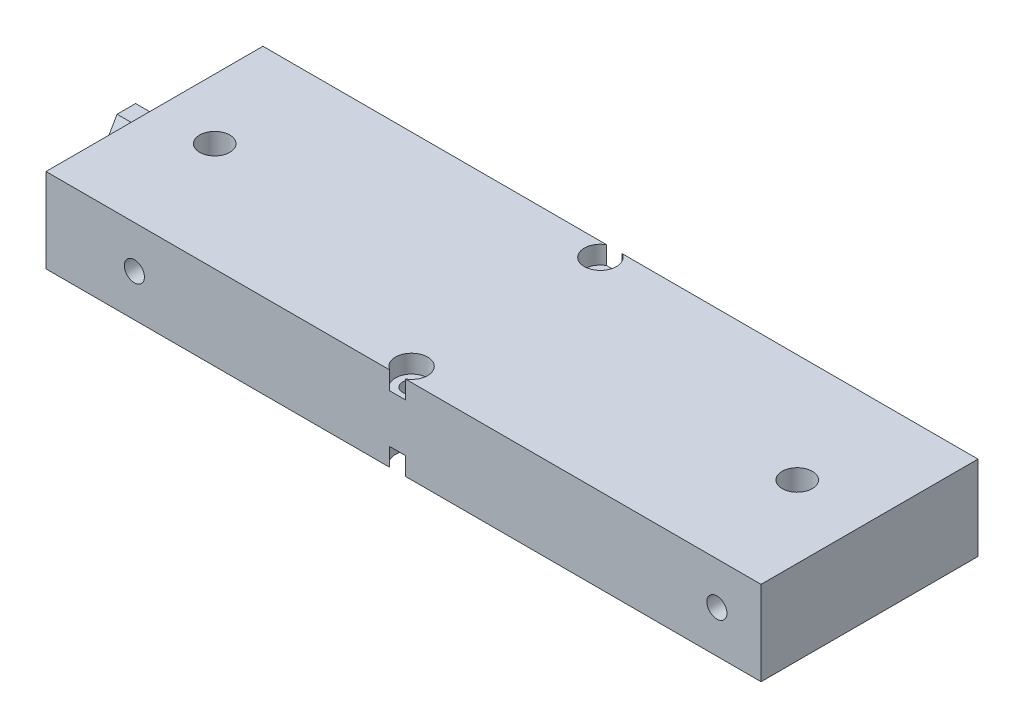
from build123d import *

# Parameters (mm, degrees)
SKETCH_1_W          = 178
SKETCH_1_H          = 54
EXTRUDE_1_DEPTH     = 21
SKETCH_2_R          = 4
CUT_EXTRUDE_1_DEPTH = 125
SKETCH_3_R          = 2.25
CUT_EXTRUDE_2_DEPTH = 188.192414376
SKETCH_4_R          = 4
CUT_EXTRUDE_3_DEPTH = 4.5
SKETCH_5_R          = 3.75
CUT_EXTRUDE_4_DEPTH = 7.2
SKETCH_6_R          = 2.5
CUT_EXTRUDE_5_DEPTH = 5
EXTRUDE_2_DEPTH     = 7


with BuildPart() as part:
    # 草图1 → 凸台-拉伸1 (new body)
    with BuildSketch(Plane(origin=(0, 0, 0), x_dir=(1, 0, 0), z_dir=(0, 1, 0))):
        with Locations((89, 27)):
            Rectangle(SKETCH_1_W, SKETCH_1_H)
    extrude(amount=EXTRUDE_1_DEPTH)

    # 草图2 → 切除-拉伸1 (cut)
    with BuildSketch(Plane.ZY):
        with Locations((-15, 10.5)):
            Circle(SKETCH_2_R)
        with Locations(Location((-39, 10.5, 0), (0, 0, 180))):
            Circle(SKETCH_2_R)
    extrude(amount=-CUT_EXTRUDE_1_DEPTH, mode=Mode.SUBTRACT)

    # 草图3 → 切除-拉伸2 (cut, through all)
    with BuildSketch(Plane(origin=(0, 21, 0), x_dir=(1, 0, 0), z_dir=(0, 1, 0))):
        with Locations(Location((87.5, 3.5, 0), (0, 0, 270))):
            Circle(SKETCH_3_R)
        with Locations(Location((87.5, 50.5, 0), (0, 0, 270))):
            Circle(SKETCH_3_R)
        with Locations(Location((15, 27, 0), (0, 0, 270))):
            Circle(SKETCH_3_R)
        with Locations(Location((160, 27, 0), (0, 0, 270))):
            Circle(SKETCH_3_R)
    extrude(amount=-CUT_EXTRUDE_2_DEPTH, mode=Mode.SUBTRACT)

    # 草图4 → 切除-拉伸3 (cut)
    with BuildSketch(Plane(origin=(0, 21, 0), x_dir=(1, 0, 0), z_dir=(0, 1, 0))):
        with Locations((87.5, 50.5)):
            Circle(SKETCH_4_R)
        with Locations((87.5, 3.5)):
            Circle(SKETCH_4_R)
    cut_extrude_3 = extrude(amount=-CUT_EXTRUDE_3_DEPTH, mode=Mode.SUBTRACT)

    # 草图5 → 切除-拉伸4 (cut)
    with BuildSketch(Plane(origin=(0, 21, 0), x_dir=(1, 0, 0), z_dir=(0, 1, 0))):
        with Locations(Location((160, 27, 0), (0, 0, 270))):
            Circle(SKETCH_5_R)
        with Locations(Location((15, 27, 0), (0, 0, 270))):
            Circle(SKETCH_5_R)
    cut_extrude_4 = extrude(amount=-CUT_EXTRUDE_4_DEPTH, mode=Mode.SUBTRACT)

    # 镜向1: 切除-拉伸3, 切除-拉伸4 across plane
    add(cut_extrude_3.mirror(Plane(origin=(0, 10.5, 0), x_dir=(0, 0, 1), z_dir=(0, -1, 0))), mode=Mode.SUBTRACT)
    add(cut_extrude_4.mirror(Plane(origin=(0, 10.5, 0), x_dir=(0, 0, 1), z_dir=(0, -1, 0))), mode=Mode.SUBTRACT)

    # 草图6 → 切除-拉伸5 (cut)
    with BuildSketch(Plane.XY):
        with Locations((22, 10.5)):
            Circle(SKETCH_6_R)
        with Locations((167, 10.5)):
            Circle(SKETCH_6_R)
    extrude(amount=-CUT_EXTRUDE_5_DEPTH, mode=Mode.SUBTRACT)

    # 草图7 → 凸台-拉伸2 (add)
    with BuildSketch(Plane.ZY):
        Polygon((-24.690598923, 17.5), (-29.309401077, 17.5), (-31.618802154, 13.5), (-29.309401077, 9.5), (-24.690598923, 9.5), (-22.381197846, 13.5), align=None)
    extrude(amount=EXTRUDE_2_DEPTH)


solid = part.part
